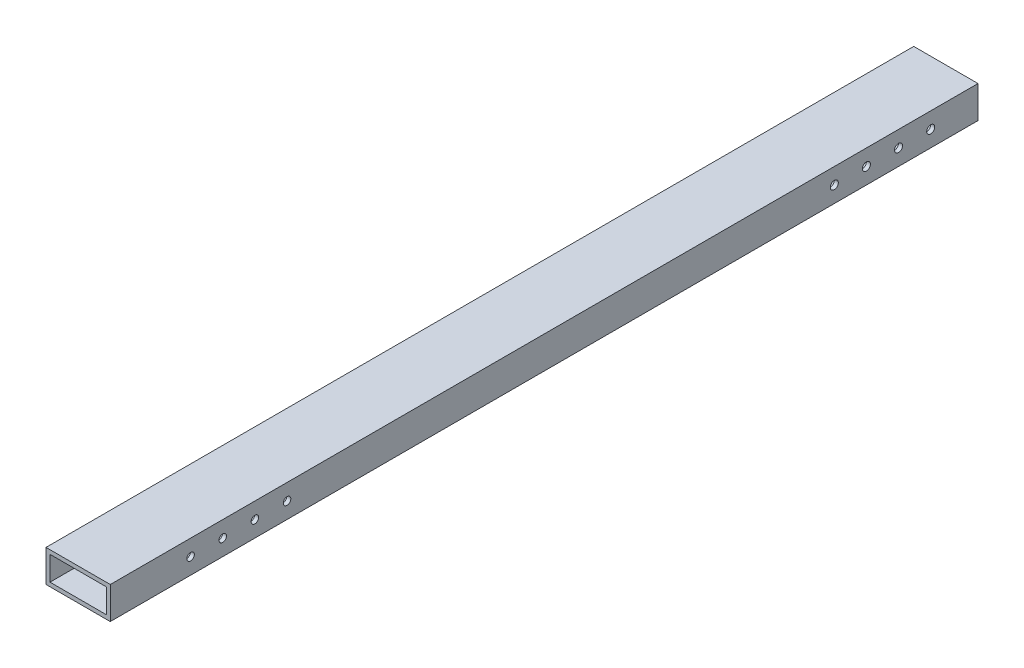
from build123d import *

# Parameters (mm, degrees)
BOSS_EXTRUDE1_DEPTH         = 342.9
BOSS_EXTRUDE1_DEPTH_BACK    = 342.9
SKETCH3_W                   = 50.8
SKETCH3_H                   = 25.4
SKETCH3_W_2                 = 44.45
SKETCH3_H_2                 = 19.05
A_0_234_DIAMETER_HOLE1_D    = 5.9436
F_1_4_0_25_DIAMETER_HOLE2_D = 6.35


with BuildPart() as part:
    # Sketch3 → Boss-Extrude1 (new, two sides: drawn at the far end of the back side and taken through both)
    with BuildSketch(Plane.XY.offset(-BOSS_EXTRUDE1_DEPTH_BACK)):
        Rectangle(SKETCH3_W, SKETCH3_H)
        Rectangle(SKETCH3_W_2, SKETCH3_H_2, mode=Mode.SUBTRACT)
    extrude(amount=BOSS_EXTRUDE1_DEPTH + BOSS_EXTRUDE1_DEPTH_BACK)

    # A (0.234) Diameter Hole1 (through all)
    with Locations(Plane(origin=(25.4, 0, 0), x_dir=(0, 0, -1), z_dir=(1, 0, 0))):
        with Locations((-279.4, 0), (-254, 0), (-228.6, 0), (-203.2, 0)):
            Hole(A_0_234_DIAMETER_HOLE1_D / 2)

    # 1/4 (0.25) Diameter Hole2 (through all)
    with Locations(Plane(origin=(25.4, 0, 0), x_dir=(0, 0, -1), z_dir=(1, 0, 0))):
        with Locations((305.511799988, 0), (280.111799988, 0), (254.711799988, 0), (229.311799988, 0)):
            Hole(F_1_4_0_25_DIAMETER_HOLE2_D / 2)


solid = part.part
